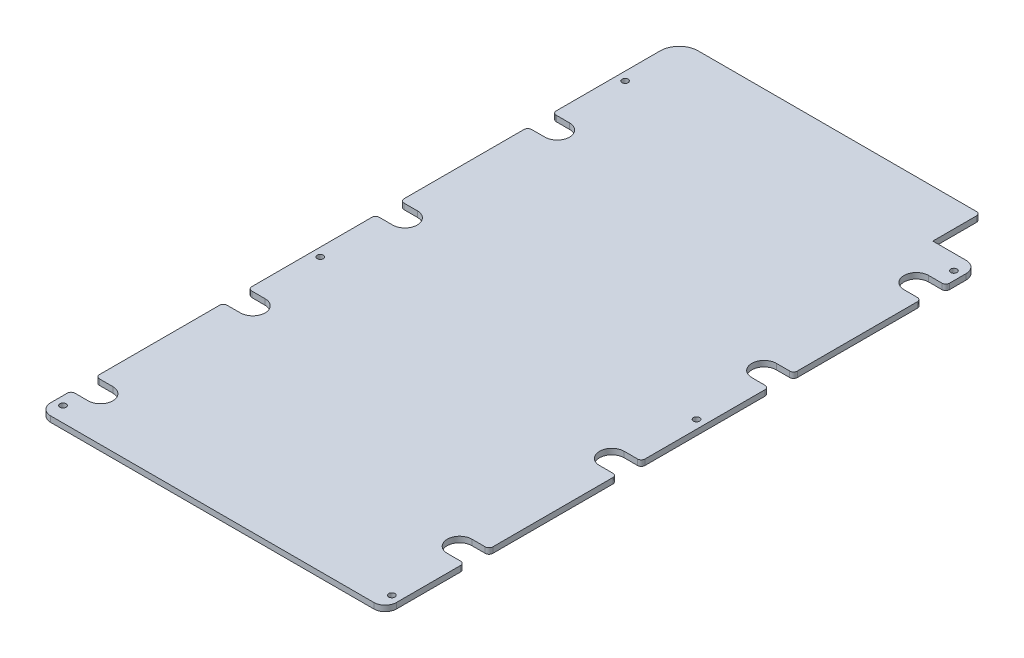
from build123d import *

# Parameters (mm, degrees)
SKETCH1_W                 = 158.69
SKETCH1_H                 = 25
BOSS_EXTRUDE1_DEPTH       = 3
FILLET1_R                 = 10
FILLET2_R                 = 6
F_4_CLEARANCE_HOLE1_D     = 3.2639
F_4_CLEARANCE_HOLE1_DEPTH = 3
F_4_CLEARANCE_HOLE1_TIP   = 0.980574487
FILLET3_R                 = 2


with BuildPart() as part:
    # Sketch1 → Boss-Extrude1 (new body)
    with BuildSketch(Plane(origin=(0, 0, 0), x_dir=(1, 0, 0), z_dir=(0, 1, 0))):
        with BuildLine():
            Line((-91.15, 34.109827366), (-82.15, 34.109827366))
            ThreePointArc((-82.15, 34.109827366), (-75.65, 27.609827366), (-82.15, 21.109827366))
            Line((-82.15, 21.109827366), (-91.15, 21.109827366))
            Line((-91.15, 21.109827366), (-91.15, -46.140172634))
            Line((-91.15, -46.140172634), (-82.15, -46.140172634))
            ThreePointArc((-82.15, -46.140172634), (-75.65, -52.640172634), (-82.15, -59.140172634))
            Line((-82.15, -59.140172634), (-91.15, -59.140172634))
            Line((-91.15, -59.140172634), (-91.15, -126.390172634))
            Line((-91.15, -126.390172634), (-82.15, -126.390172634))
            ThreePointArc((-82.15, -126.390172634), (-75.65, -132.890172634), (-82.15, -139.390172634))
            Line((-82.15, -139.390172634), (-91.15, -139.390172634))
            Line((-91.15, -139.390172634), (-91.15, -156.140172634))
            Line((-91.15, -156.140172634), (91.15, -156.140172634))
            Line((91.15, -156.140172634), (91.15, -114.390172634))
            Line((91.15, -114.390172634), (82.15, -114.390172634))
            ThreePointArc((82.15, -114.390172634), (75.65, -107.890172634), (82.15, -101.390172634))
            Line((82.15, -101.390172634), (91.15, -101.390172634))
            Line((91.15, -101.390172634), (91.15, -34.140172634))
            Line((91.15, -34.140172634), (82.15, -34.140172634))
            ThreePointArc((82.15, -34.140172634), (75.65, -27.640172634), (82.15, -21.140172634))
            Line((82.15, -21.140172634), (91.15, -21.140172634))
            Line((91.15, -21.140172634), (91.15, 46.109827366))
            Line((91.15, 46.109827366), (82.15, 46.109827366))
            ThreePointArc((82.15, 46.109827366), (75.65, 52.609827366), (82.15, 59.109827366))
            Line((82.15, 59.109827366), (91.15, 59.109827366))
            Line((91.15, 59.109827366), (91.15, 126.359827366))
            Line((91.15, 126.359827366), (82.15, 126.359827366))
            ThreePointArc((82.15, 126.359827366), (75.65, 132.859827366), (82.15, 139.359827366))
            Line((82.15, 139.359827366), (91.15, 139.359827366))
            Line((91.15, 139.359827366), (91.15, 156.140172634))
            Line((91.15, 156.140172634), (67.54, 156.140172634))
            Line((67.54, 156.140172634), (-91.15, 156.140172634))
            Line((-91.15, 156.140172634), (-91.15, 114.359827366))
            Line((-91.15, 114.359827366), (-82.15, 114.359827366))
            ThreePointArc((-82.15, 114.359827366), (-75.65, 107.859827366), (-82.15, 101.359827366))
            Line((-82.15, 101.359827366), (-91.15, 101.359827366))
            Line((-91.15, 101.359827366), (-91.15, 34.109827366))
        make_face()
        with Locations((-11.805, 168.640172634)):
            Rectangle(SKETCH1_W, SKETCH1_H)
    extrude(amount=BOSS_EXTRUDE1_DEPTH)

    # Fillet1
    fillet1_edges = [part.edges().sort_by_distance(p)[0] for p in [
        (-91.15, 1.5, -181.140172634),
    ]]
    fillet(fillet1_edges, radius=FILLET1_R)

    # Fillet2
    fillet2_edges = [part.edges().sort_by_distance(p)[0] for p in [
        (91.15, 1.5, 156.140172634),
        (-91.15, 1.5, 156.140172634),
        (91.15, 1.5, -156.140172634),
    ]]
    fillet(fillet2_edges, radius=FILLET2_R)

    # #4 Clearance Hole1
    with Locations(Plane(origin=(0, 3, 0), x_dir=(1, 0, 0), z_dir=(0, 1, 0))):
        with Locations((86.65, 148.140172634), (-86.65, -148.140172634), (-86.65, -12.515172634), (-86.65, 148.140172634), (86.65, 12.484827366), (86.65, -148.140172634)):
            Hole(F_4_CLEARANCE_HOLE1_D / 2, depth=F_4_CLEARANCE_HOLE1_DEPTH)
            with Locations((0, 0, -(F_4_CLEARANCE_HOLE1_DEPTH + F_4_CLEARANCE_HOLE1_TIP / 2))):  # 118° drill point
                Cone(0, F_4_CLEARANCE_HOLE1_D / 2, F_4_CLEARANCE_HOLE1_TIP, mode=Mode.SUBTRACT)

    # Fillet3
    fillet3_edges = [part.edges().sort_by_distance(p)[0] for p in [
        (67.54, 1.5, -181.140172634),
        (91.15, 1.5, -126.359827366),
        (91.15, 1.5, -59.109827366),
        (91.15, 1.5, -46.109827366),
        (91.15, 1.5, 21.140172634),
        (91.15, 1.5, 34.140172634),
        (91.15, 1.5, 101.390172634),
        (91.15, 1.5, 114.390172634),
        (-91.15, 1.5, 139.390172634),
        (-91.15, 1.5, 126.390172634),
        (-91.15, 1.5, 59.140172634),
        (-91.15, 1.5, 46.140172634),
        (-91.15, 1.5, -21.109827366),
        (-91.15, 1.5, -34.109827366),
        (-91.15, 1.5, -101.359827366),
        (-91.15, 1.5, -114.359827366),
        (91.15, 1.5, -139.359827366),
    ]]
    fillet(fillet3_edges, radius=FILLET3_R)


solid = part.part
